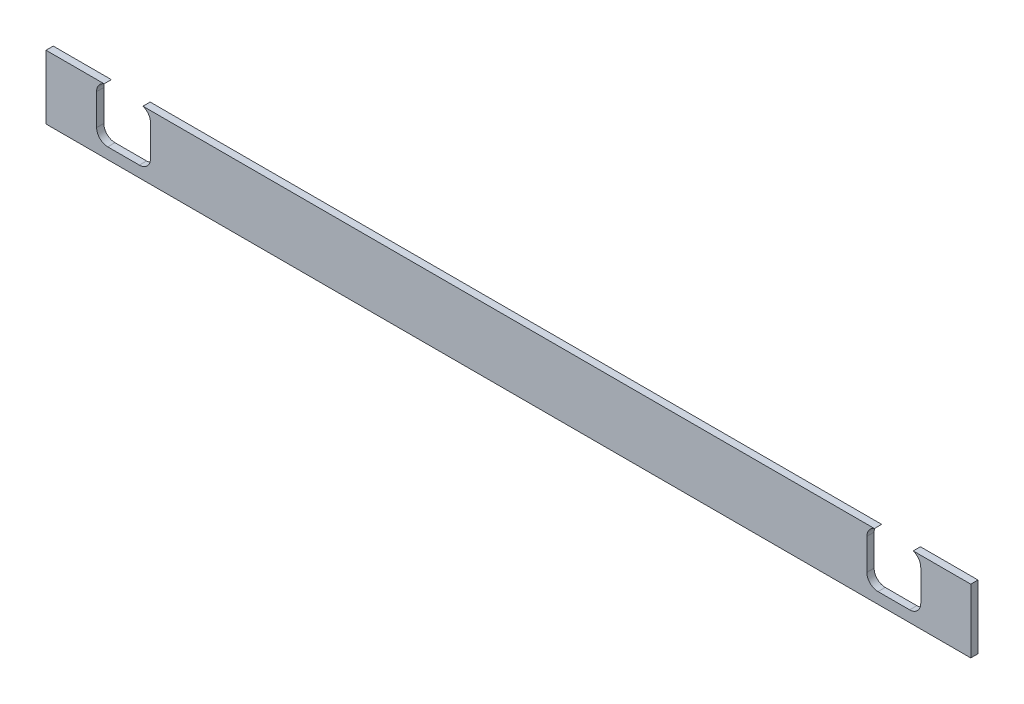
from build123d import *

# Parameters (mm, degrees)
ESQUISSE1_W                = 832
ESQUISSE1_H                = 57.5
BOSS_EXTRU_1_DEPTH         = 6.5
ENL_V_MAT_EXTRU_1_DEPTH    = 418.042938437
R_P_TITION_LIN_AIRE1_COUNT = 2
R_P_TITION_LIN_AIRE1_PITCH = 693


with BuildPart() as part:
    # Esquisse1 → Boss.-Extru.1 (new body)
    with BuildSketch(Plane.XY):
        Rectangle(ESQUISSE1_W, ESQUISSE1_H)
    extrude(amount=BOSS_EXTRU_1_DEPTH)

    # Esquisse2 → Enlèv. mat.-Extru.1 (cut, through all)
    with BuildSketch(Plane(origin=(0, 0, 0), x_dir=(-1, 0, 0), z_dir=(0, 0, -1))):
        with BuildLine():
            Line((-361, -18.771350197), (-332.52602316, -18.771350197))
            ThreePointArc((-332.52602316, -18.771350197), (-325.454955349, -15.842418009), (-322.52602316, -8.771350197))
            Line((-322.52602316, -8.771350197), (-322.52602316, 19.274771524))
            ThreePointArc((-322.52602316, 19.274771524), (-325.454955349, 26.345839336), (-332.52602316, 29.274771524))
            Line((-332.52602316, 29.274771524), (-361, 29.274771524))
            ThreePointArc((-361, 29.274771524), (-368.071067812, 26.345839336), (-371, 19.274771524))
            Line((-371, 19.274771524), (-371, -8.771350197))
            ThreePointArc((-371, -8.771350197), (-368.071067812, -15.842418009), (-361, -18.771350197))
        make_face()
    enl_v_mat_extru_1 = extrude(amount=-ENL_V_MAT_EXTRU_1_DEPTH, mode=Mode.SUBTRACT)

    # Répétition linéaire1: Enlèv. mat.-Extru.1 ×2
    with Locations(*[(-i * R_P_TITION_LIN_AIRE1_PITCH, 0, 0) for i in range(1, R_P_TITION_LIN_AIRE1_COUNT)]):
        add(enl_v_mat_extru_1, mode=Mode.SUBTRACT)


solid = part.part
